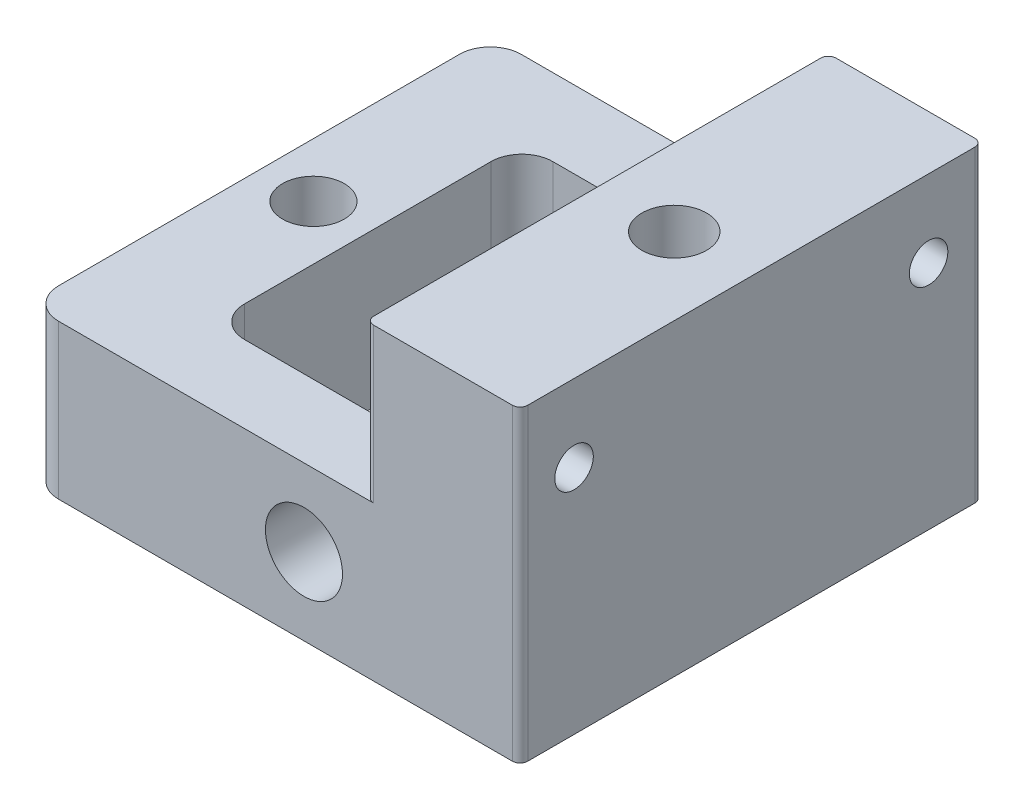
from build123d import *

# Parameters (mm, degrees)
SKETCH1_W                   = 31.93
SKETCH1_H                   = 30
SKETCH1_W_2                 = 14.88
SKETCH1_H_2                 = 20
BOSS_EXTRUDE1_DEPTH         = 10
SKETCH2_W                   = 10
SKETCH2_H                   = 30
BOSS_EXTRUDE2_DEPTH         = 10
TAP_DRILL_FOR_M5X0_8_TAP1_D = 4.2
FILLET2_R                   = 2
SKETCH5_R                   = 2.5
CUT_EXTRUDE2_DEPTH          = 37.457558887
TAP_DRILL_FOR_M4X0_7_TAP1_D = 3.3
FILLET3_R                   = 2
FILLET4_R                   = 0.5
TAP_DRILL_FOR_M3X0_5_TAP1_D = 2.5
F_4_0_4_DIAMETER_HOLE1_D    = 4


with BuildPart() as part:
    # Sketch1 → Boss-Extrude1 (new body)
    with BuildSketch(Plane(origin=(0, 0, 0), x_dir=(1, 0, 0), z_dir=(0, 1, 0))):
        with Locations((1.475, 0)):
            Rectangle(SKETCH1_W, SKETCH1_H)
        Rectangle(SKETCH1_W_2, SKETCH1_H_2, mode=Mode.SUBTRACT)
    extrude(amount=BOSS_EXTRUDE1_DEPTH)

    # Sketch2 → Boss-Extrude2 (add)
    with BuildSketch(Plane(origin=(0, 10, 0), x_dir=(1, 0, 0), z_dir=(0, 1, 0))):
        with Locations((12.44, 0)):
            Rectangle(SKETCH2_W, SKETCH2_H)
    extrude(amount=BOSS_EXTRUDE2_DEPTH)

    # Tap Drill for M5x0.8 Tap1 (through all)
    with Locations(Plane(origin=(0, 20, 0), x_dir=(1, 0, 0), z_dir=(0, 1, 0))):
        with Locations((12.44, 0)):
            Hole(TAP_DRILL_FOR_M5X0_8_TAP1_D / 2)

    # Fillet2
    fillet2_edges = [part.edges().sort_by_distance(p)[0] for p in [
        (-7.44, 5, -10),
        (-7.44, 5, 10),
        (7.44, 5, 10),
        (7.44, 5, -10),
    ]]
    fillet(fillet2_edges, radius=FILLET2_R)

    # Sketch5 → Cut-Extrude2 (cut, through all)
    with BuildSketch(Plane.XY.offset(-10)):
        with Locations(Location((3.42, 5, 0), (0, 0, 323.900983741))):
            Circle(SKETCH5_R)
    extrude(amount=CUT_EXTRUDE2_DEPTH, mode=Mode.SUBTRACT)

    # Tap Drill for M4x0.7 Tap1 (through all)
    with Locations(Plane.XY.offset(-10)):
        with Locations((3.42, 5)):
            Hole(TAP_DRILL_FOR_M4X0_7_TAP1_D / 2)

    # Fillet3
    fillet3_edges = [part.edges().sort_by_distance(p)[0] for p in [
        (-14.49, 5, -15),
        (-14.49, 5, 15),
    ]]
    fillet(fillet3_edges, radius=FILLET3_R)

    # Fillet4
    fillet4_edges = [part.edges().sort_by_distance(p)[0] for p in [
        (7.44, 15, -15),
        (7.44, 15, 15),
        (17.44, 10, -15),
        (17.44, 10, 15),
    ]]
    fillet(fillet4_edges, radius=FILLET4_R)

    # Tap Drill for M3x0.5 Tap1 (through all)
    with Locations(Plane.ZY.offset(-7.44)):
        with Locations((-11.5, 15), (11.5, 15)):
            Hole(TAP_DRILL_FOR_M3X0_5_TAP1_D / 2)

    # Ø4.0 (4) Diameter Hole1 (through all)
    with Locations(Plane(origin=(0, 10, 0), x_dir=(1, 0, 0), z_dir=(0, 1, 0))):
        with Locations((-10.965, 0)):
            Hole(F_4_0_4_DIAMETER_HOLE1_D / 2)


solid = part.part
